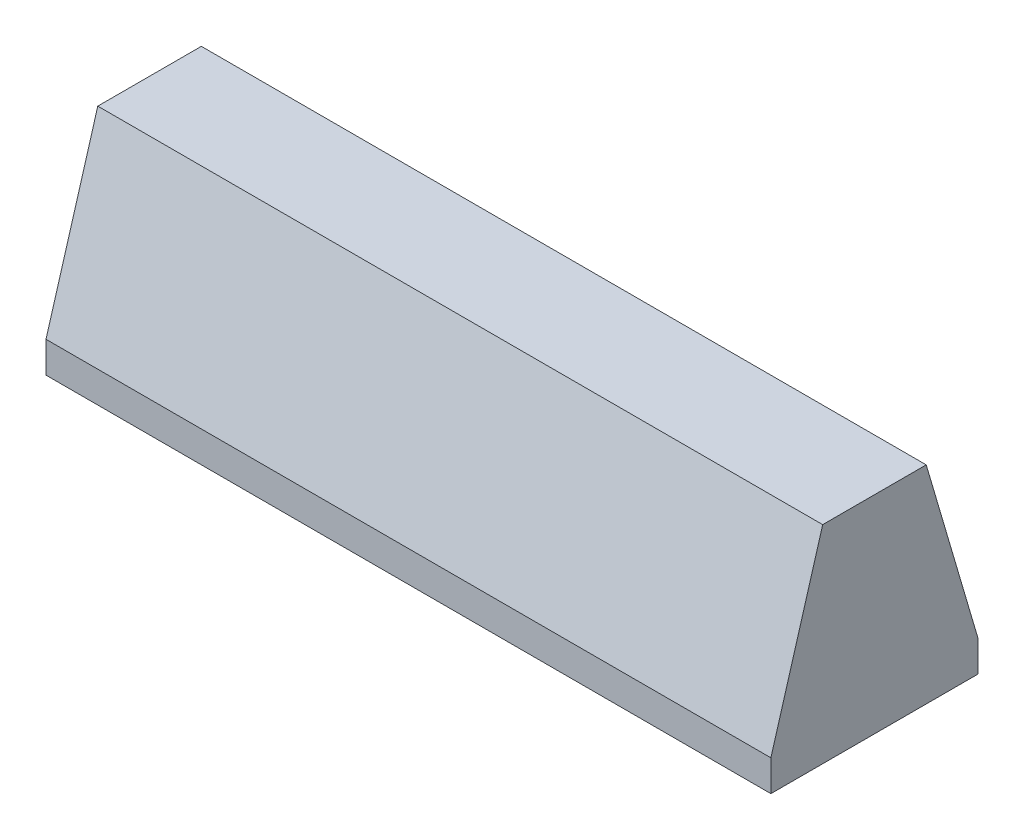
from build123d import *
from OCP.BRepFilletAPI import BRepFilletAPI_MakeChamfer

# Parameters (mm, degrees)
SKETCH1_W           = 70
SKETCH1_H           = 20
BOSS_EXTRUDE1_DEPTH = 20
CHAMFER1_SIZE       = 17
CHAMFER1_SIZE2      = 5


with BuildPart() as part:
    # Sketch1 → Boss-Extrude1 (new body)
    with BuildSketch(Plane(origin=(0, 0, 0), x_dir=(1, 0, 0), z_dir=(0, 1, 0))):
        with Locations((35, 10)):
            Rectangle(SKETCH1_W, SKETCH1_H)
    extrude(amount=BOSS_EXTRUDE1_DEPTH)

    # Chamfer1: one chamfer whose edges measure the first distance from different faces: ONE call of the kernel's chamfer builder (chamfer() names one face for all edges)
    chamfer1_edges_1 = [part.edges().sort_by_distance(p)[0] for p in [
        (35, 20, -20),
    ]]
    chamfer1_side_1 = [part.faces().sort_by_distance(p)[0] for p in [
        (35, 10, -20),
    ]]
    chamfer1_edges_2 = [part.edges().sort_by_distance(p)[0] for p in [
        (35, 20, 0),
    ]]
    chamfer1_side_2 = [part.faces().sort_by_distance(p)[0] for p in [
        (35, 10, 0),
    ]]
    chamfer1 = BRepFilletAPI_MakeChamfer(part.part.solid().wrapped)
    for e in chamfer1_edges_1:
        chamfer1.Add(CHAMFER1_SIZE, CHAMFER1_SIZE2, e.wrapped, chamfer1_side_1[0].wrapped)  # the first distance lies on this face
    for e in chamfer1_edges_2:
        chamfer1.Add(CHAMFER1_SIZE, CHAMFER1_SIZE2, e.wrapped, chamfer1_side_2[0].wrapped)  # the first distance lies on this face
    add(Compound.cast(chamfer1.Shape()), mode=Mode.REPLACE)


solid = part.part
